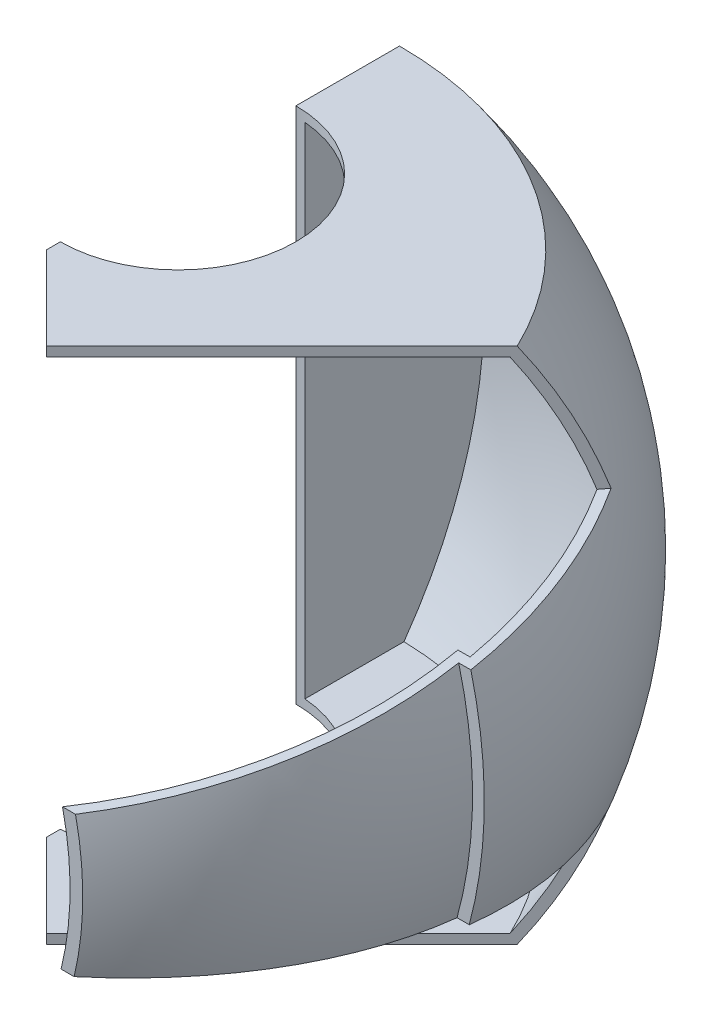
from build123d import *

# Parameters (mm, degrees)
OBR_T1_ANGLE                = 180.0000000000004
WYTNIJ_WYCI_GNI_CIE6_DEPTH  = 172.4642819948225
WYTNIJ_WYCI_GNI_CIE7_DEPTH  = 166.27116841238856
DODANIE_WYCI_GNI_CIE2_DEPTH = 100
WYTNIJ_WYCI_GNI_CIE8_DEPTH  = 172.45844977719824
WYCI_CIE_OBR_T2_ANGLE       = 90.0000000000002
WYTNIJ_WYCI_GNI_CIE9_DEPTH  = 172.45844977719824
SKORUPA2_T                  = -2


with BuildPart() as part:
    # Szkic1 → Obrót1 (revolve)
    with BuildSketch(Plane(origin=(0, 0, 0), x_dir=(0, 0, -1), z_dir=(1, 0, 0))):
        with BuildLine():
            Line((0, -55), (0, 55))
            Line((0, 55), (-75, 54.99999999999999))
            ThreePointArc((-75, 54.99999999999999), (-93.00537618869137, 1.139e-14), (-75, -54.99999999999999))
            Line((-75, -54.99999999999999), (0, -55))
        make_face()
    revolve(axis=Axis((0, -55, 0), (0, 1, 0)), revolution_arc=OBR_T1_ANGLE)

    # Szkic2 → Wytnij-wyciągnięcie6 (cut, through all)
    with BuildSketch(Plane.XZ.offset(54.99999999999998)):
        with BuildLine():
            Line((-50.14037658161271, 0), (-26.065901524307794, 0))
            Line((-26.065901524307794, 0), (-26.065901524307794, 75.00000000000003))
            Line((-26.065901524307794, 75.00000000000003), (0, 75.00000000000003))
            ThreePointArc((-7.11e-15, 75.00000000000004), (6.164498496803606, 74.74623039513706), (12.28728066433489, 73.98663888754419))
            ThreePointArc((12.287280664334872, 73.9866388875442), (66.51313822370639, 34.6554821584426), (67.6776695296636, -32.32233047033656))
            Line((67.6776695296636, -32.32233047033656), (87.35369951614506, -51.99836045681815))
            Line((87.35369951614506, -51.99836045681814), (99.7170587397922, -51.99836045681808))
            Line((99.7170587397922, -51.99836045681808), (99.7170587397922, 112.3930651923552))
            Line((99.71705873979221, 112.3930651923552), (-50.14037658161271, 112.3930651923552))
            Line((-50.14037658161271, 112.3930651923552), (-50.14037658161271, 0))
        make_face()
    extrude(amount=-WYTNIJ_WYCI_GNI_CIE6_DEPTH, mode=Mode.SUBTRACT)

    # Szkic6 → Wytnij-wyciągnięcie7 (cut, through all)
    with BuildSketch(Plane.XZ.offset(54.99999999999998)):
        with BuildLine():
            ThreePointArc((67.67766952966359, -32.32233047033659), (63.4396358173472, 40.00515725956293), (5.5067e-13, 75.00000000000003))
            Line((5.375e-13, 75.00000000000003), (-4.59e-15, 0))
            Line((0, 0), (17.677669529663717, 17.67766952966366))
            Line((17.677669529663717, 17.67766952966366), (67.6776695296636, -32.32233047033657))
        make_face()
    extrude(amount=-WYTNIJ_WYCI_GNI_CIE7_DEPTH, mode=Mode.SUBTRACT)

    # Szkic7 → Dodanie-wyciągnięcie2 (add)
    with BuildSketch(Plane(origin=(100, 0, 0), x_dir=(0, 0, -1), z_dir=(1, 0, 0))):
        Polygon((-60, -15.653786999192038), (-60, 14.34621300080796), (45.666627766936244, 29.346213000808905), (45.666627766936244, -30.653786999192953), align=None)
    extrude(amount=-DODANIE_WYCI_GNI_CIE2_DEPTH)

    # Szkic8 → Wycięcie-obrót1 (revolve, cut)
    with BuildSketch(Plane(origin=(0, 0, 0), x_dir=(0, 0, -1), z_dir=(1, 0, 0))):
        with BuildLine():
            Line((-74.9933330370107, 55.00000000000001), (-155.56349186104046, 55.00000000000001))
            ThreePointArc((-155.56349186104046, 55.00000000000001), (-165, 2.021e-14), (-155.56349186104046, -54.999999999999964))
            Line((-155.56349186104046, -54.999999999999964), (-74.99333303701071, -54.99999999999997))
            ThreePointArc((-74.99333303701071, -54.99999999999997), (-93, 1.139e-14), (-74.9933330370107, 55.00000000000001))
        make_face()
    revolve(axis=Axis((0, 0, 0), (0, 1, 0)), mode=Mode.SUBTRACT)

    # Szkic9 → Wytnij-wyciągnięcie8 (cut, through all)
    with BuildSketch(Plane.XZ.offset(54.99999999999998)):
        Polygon((-4.3e-16, -4.3e-16), (84.28181453760202, 84.28181453760173), (-46.691543450070924, 84.28181453760173), (-46.691543450070924, 0), align=None)
    extrude(amount=-WYTNIJ_WYCI_GNI_CIE8_DEPTH, mode=Mode.SUBTRACT)

    # Szkic10 → Wycięcie-obrót2 (revolve, cut)
    with BuildSketch(Plane(origin=(0, 0, 0), x_dir=(0, 0, -1), z_dir=(1, 0, 0))):
        with BuildLine():
            Line((-71.86967371569179, 55.00000000000001), (-106.6536450385077, 55.00000000000001))
            ThreePointArc((-106.6536450385077, 55.00000000000001), (-120, 1.47e-14), (-106.65364503850772, -54.99999999999998))
            Line((-106.65364503850772, -54.99999999999998), (-71.8696737156918, -54.99999999999998))
            ThreePointArc((-71.8696737156918, -54.99999999999998), (-90.5, 1.108e-14), (-71.86967371569179, 55.00000000000001))
        make_face()
    revolve(axis=Axis((0, 0, 0), (0, 1, 0)), revolution_arc=WYCI_CIE_OBR_T2_ANGLE, mode=Mode.SUBTRACT)

    # Szkic11 → Wytnij-wyciągnięcie9 (cut, through all)
    with BuildSketch(Plane.XZ.offset(54.99999999999998)):
        with BuildLine():
            ThreePointArc((25.000000000000004, -28), (17.67766952966355, -10.32233047033617), (-3.9815e-13, -2.9999999999999964))
            Line((0, -2.9999999999999964), (0, -28))
            Line((-1.9552e-13, -28), (-3.701e-13, -53))
            ThreePointArc((-6.7073e-13, -53), (17.67766952966345, -45.67766952966393), (25.000000000000004, -28.000000000000007))
        make_face()
        with BuildLine():
            Line((0, -28), (0, -2.9999999999999964))
            ThreePointArc((-3.9815e-13, -2.9999999999999964), (-25.000000000000004, -27.999999999999865), (-6.7073e-13, -53))
            Line((-3.701e-13, -53), (-1.9552e-13, -28))
        make_face()
    extrude(amount=-WYTNIJ_WYCI_GNI_CIE9_DEPTH, mode=Mode.SUBTRACT)

    # Skorupa2
    skorupa2_openings = [part.faces().sort_by_distance(p)[0] for p in [
        (63.613171512, -0.551610376, 60),
        (25, 0, -28),
        (21.502764512, -0.287252782, 21.502764512),
        (60.525104479, -22.455388981, 12.086510343),
        (60.727668941, 21.157570461, 12.017788444),
        (44.39246987, 39.229169277, -9.037130811),
        (0, 0, -1.5),
        (44.239594619, -39.899256445, -8.88425556),
    ]]
    offset(amount=SKORUPA2_T, openings=skorupa2_openings, kind=Kind.INTERSECTION)


solid = part.part
